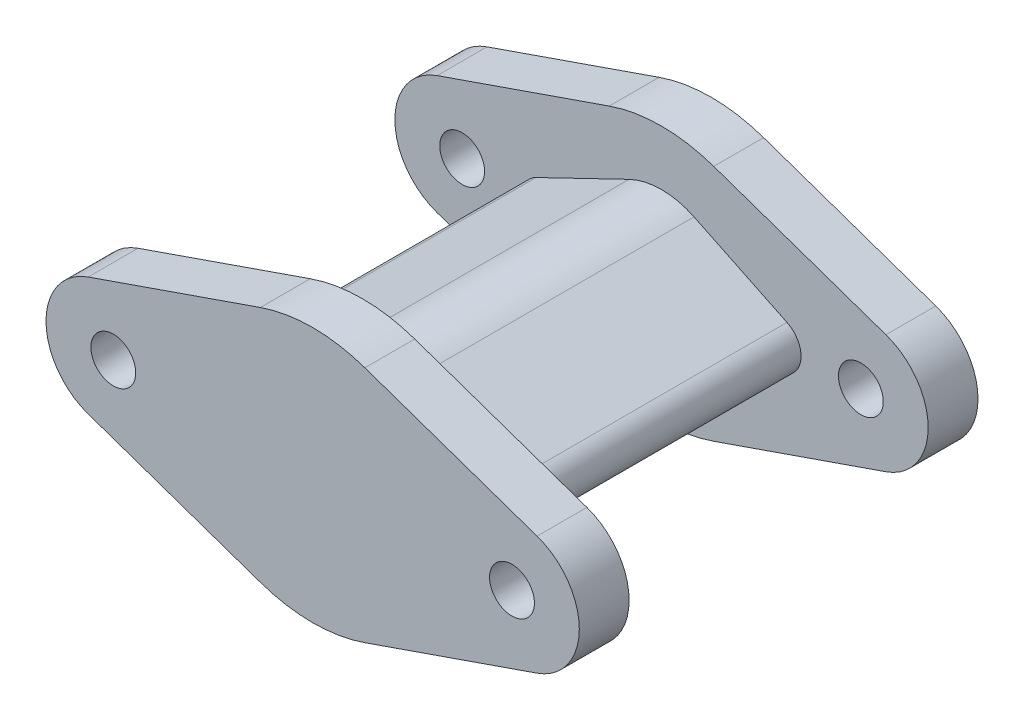
from build123d import *

# Parameters (mm, degrees)
BOSS_EXTRUDE1_DEPTH = 5
FILLET1_R           = 6.3
FILLET2_R           = 6.3
FILLET3_R           = 16
FILLET4_R           = 16
SKETCH2_R           = 2.25
CUT_EXTRUDE1_DEPTH  = 31.085285873
LPATTERN3_COUNT     = 2
LPATTERN3_PITCH     = 35
BOSS_EXTRUDE2_REACH = 47.882


with BuildPart() as part:
    # Sketch1 → Boss-Extrude1 (new body)
    with BuildSketch(Plane.XY):
        Polygon((-39.682259829, 0), (0, 13.759297035), (39.682259829, 0), (0, -13.759297035), align=None)
    extrude(amount=BOSS_EXTRUDE1_DEPTH)

    # Fillet1
    fillet1_edges = [part.edges().sort_by_distance(p)[0] for p in [
        (39.682259829, 0, 2.5),
    ]]
    fillet(fillet1_edges, radius=FILLET1_R)

    # Fillet2
    fillet2_edges = [part.edges().sort_by_distance(p)[0] for p in [
        (-39.682259829, 0, 2.5),
    ]]
    fillet(fillet2_edges, radius=FILLET2_R)

    # Fillet3
    fillet3_edges = [part.edges().sort_by_distance(p)[0] for p in [
        (0, 13.759297035, 2.5),
    ]]
    fillet(fillet3_edges, radius=FILLET3_R)

    # Fillet4
    fillet4_edges = [part.edges().sort_by_distance(p)[0] for p in [
        (0, -13.759297035, 2.5),
    ]]
    fillet(fillet4_edges, radius=FILLET4_R)

    # Sketch2 → Cut-Extrude1 (cut, through all)
    with BuildSketch(Plane.XY.offset(5)):
        with Locations((-20, 0)):
            Circle(SKETCH2_R)
        with Locations(Location((20, 0, 0), (0, 0, 180))):
            Circle(SKETCH2_R)
    extrude(amount=-CUT_EXTRUDE1_DEPTH, mode=Mode.SUBTRACT)


with BuildPart() as lpattern3_1:
    # LPattern3: pattern copy
    add(part.part.moved(Location(Vector(0, 0, 1) * (1 * LPATTERN3_PITCH))))


with BuildPart() as part_1:
    add(part.part)

    # Sketch3 → Boss-Extrude2 (add, up to next)
    with BuildSketch(Plane.XY.offset(5), mode=Mode.PRIVATE) as boss_extrude2_sk1:
        with BuildLine():
            Line((-3.260869565, 6.564853587), (-12.586956522, 2.062176374))
            ThreePointArc((-12.586956522, 2.062176374), (-14, -0.189162232), (-12.586956522, -2.440500838))
            Line((-12.586956522, -2.440500838), (-3.260869565, -6.943178051))
            ThreePointArc((-3.260869565, -6.943178051), (0, -7.689162232), (3.260869565, -6.943178051))
            Line((3.260869565, -6.943178051), (12.586956522, -2.440500838))
            ThreePointArc((12.586956522, -2.440500838), (14, -0.189162232), (12.586956522, 2.062176374))
            Line((12.586956522, 2.062176374), (3.260869565, 6.564853587))
            ThreePointArc((3.260869565, 6.564853587), (0, 7.310837768), (-3.260869565, 6.564853587))
        make_face()
    boss_extrude2_tool1 = extrude(boss_extrude2_sk1.sketch, amount=BOSS_EXTRUDE2_REACH, mode=Mode.PRIVATE) - lpattern3_1.part
    add(boss_extrude2_tool1.solids().sort_by_distance((0, -0.189162, 5))[0])


solid = Compound([lpattern3_1.part, part_1.part])
